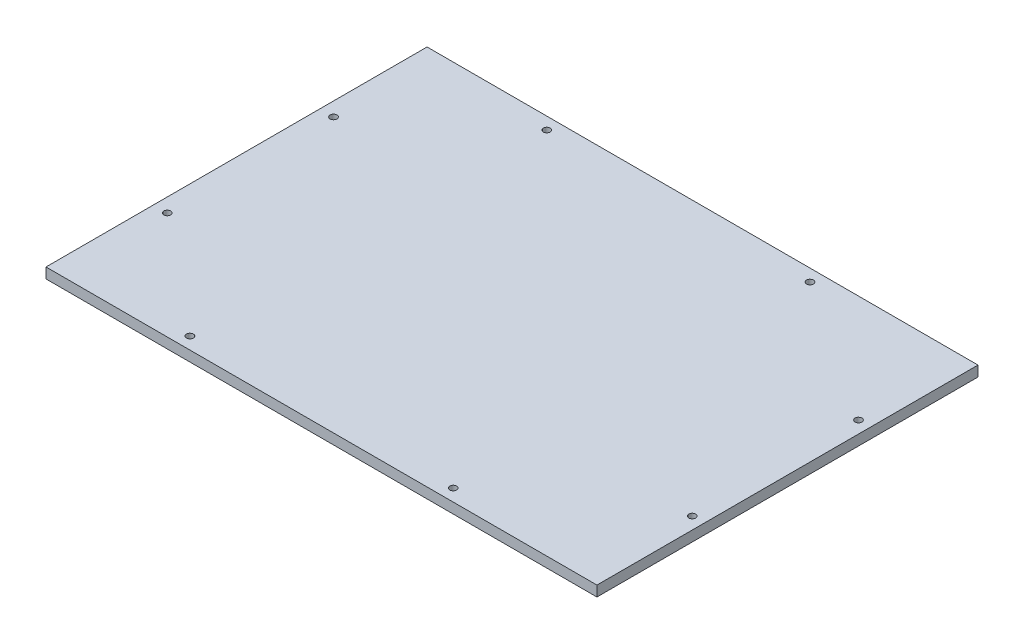
from build123d import *

# Parameters (mm, degrees)
SKETCH1_W           = 504.952
SKETCH1_H           = 349.25
BOSS_EXTRUDE1_DEPTH = 9.525
SKETCH2_R           = 3.175
CUT_EXTRUDE1_DEPTH  = 12.7


with BuildPart() as part:
    # Sketch1 → Boss-Extrude1 (new body)
    with BuildSketch(Plane(origin=(0, 0, 0), x_dir=(1, 0, 0), z_dir=(0, 1, 0))):
        with Locations((-252.476, -174.625)):
            Rectangle(SKETCH1_W, SKETCH1_H)
    extrude(amount=BOSS_EXTRUDE1_DEPTH)

    # Sketch2 → Cut-Extrude1 (cut)
    with BuildSketch(Plane(origin=(0, 9.525, 0), x_dir=(1, 0, 0), z_dir=(0, 1, 0))):
        with Locations(Location((-384.175, -11.1125, 0), (0, 0, 270))):
            Circle(SKETCH2_R)
        with Locations(Location((-142.875, -11.1125, 0), (0, 0, 270))):
            Circle(SKETCH2_R)
        with Locations(Location((-11.1125, -98.425, 0), (0, 0, 270))):
            Circle(SKETCH2_R)
        with Locations(Location((-11.1125, -250.825, 0), (0, 0, 270))):
            Circle(SKETCH2_R)
        with Locations(Location((-142.875, -338.1375, 0), (0, 0, 270))):
            Circle(SKETCH2_R)
        with Locations(Location((-384.175, -338.1375, 0), (0, 0, 270))):
            Circle(SKETCH2_R)
        with Locations(Location((-492.252, -250.825, 0), (0, 0, 270))):
            Circle(SKETCH2_R)
        with Locations(Location((-492.252, -98.425, 0), (0, 0, 270))):
            Circle(SKETCH2_R)
    extrude(amount=-CUT_EXTRUDE1_DEPTH, mode=Mode.SUBTRACT)


solid = part.part
